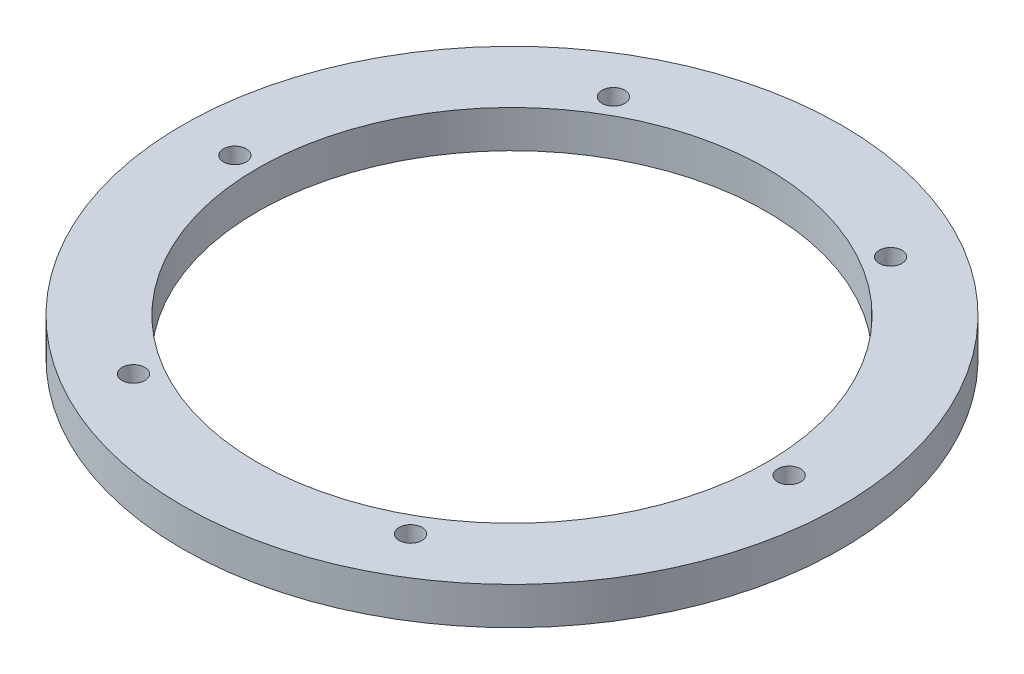
from build123d import *

# Parameters (mm, degrees)
SKETCH_1_R      = 44
SKETCH_1_R_2    = 34
SKETCH_1_R_3    = 1.525
EXTRUDE_1_DEPTH = 5


with BuildPart() as part:
    # 草图1 → 凸台-拉伸1 (new body)
    with BuildSketch(Plane(origin=(0, 0, 0), x_dir=(1, 0, 0), z_dir=(0, 1, 0))):
        with Locations(Location((0, 0, 0), (0, 0, 270))):
            Circle(SKETCH_1_R)
        with Locations(Location((0, 0, 0), (0, 0, 270))):
            Circle(SKETCH_1_R_2, mode=Mode.SUBTRACT)
        with Locations(Location((37, 0, 0), (0, 0, 270))):
            Circle(SKETCH_1_R_3, mode=Mode.SUBTRACT)
        with Locations(Location((18.5, -32.04293994, 0), (0, 0, 270))):
            Circle(SKETCH_1_R_3, mode=Mode.SUBTRACT)
        with Locations(Location((-18.5, -32.04293994, 0), (0, 0, 270))):
            Circle(SKETCH_1_R_3, mode=Mode.SUBTRACT)
        with Locations(Location((-37, 0, 0), (0, 0, 270))):
            Circle(SKETCH_1_R_3, mode=Mode.SUBTRACT)
        with Locations(Location((-18.5, 32.04293994, 0), (0, 0, 270))):
            Circle(SKETCH_1_R_3, mode=Mode.SUBTRACT)
        with Locations(Location((18.5, 32.04293994, 0), (0, 0, 270))):
            Circle(SKETCH_1_R_3, mode=Mode.SUBTRACT)
    extrude(amount=EXTRUDE_1_DEPTH)


solid = part.part
